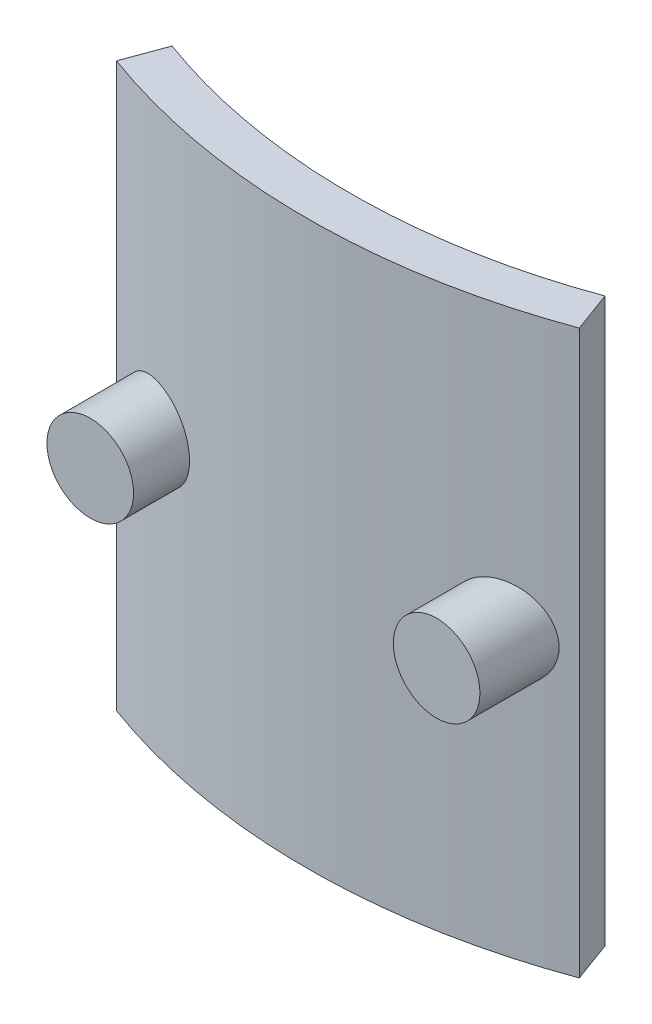
from build123d import *

# Parameters (mm, degrees)
BOSS_EXTRUDE1_DEPTH = 32.5
SKETCH2_R           = 5
BOSS_EXTRUDE2_DEPTH = 10


with BuildPart() as part:
    # Sketch1 → Boss-Extrude1 (new, symmetric)
    with BuildSketch(Plane(origin=(0, 0, 0), x_dir=(1, 0, 0), z_dir=(0, 1, 0))):
        with BuildLine():
            Line((-25, 4.446712056), (-26.724137931, -0.246618147))
            ThreePointArc((-26.724137931, -0.246618147), (0, -5), (26.724137931, -0.246618147))
            Line((26.724137931, -0.246618147), (25, 4.446712056))
            ThreePointArc((25, 4.446712056), (0, 0), (-25, 4.446712056))
        make_face()
    extrude(amount=BOSS_EXTRUDE1_DEPTH, both=True)

    # Sketch2 → Boss-Extrude2 (add)
    with BuildSketch(Plane.XY):
        with Locations(Location((-20, 0, 0), (0, 0, 180))):
            Circle(SKETCH2_R)
        with Locations(Location((20, 0, 0), (0, 0, 180))):
            Circle(SKETCH2_R)
    extrude(amount=BOSS_EXTRUDE2_DEPTH)


solid = part.part
